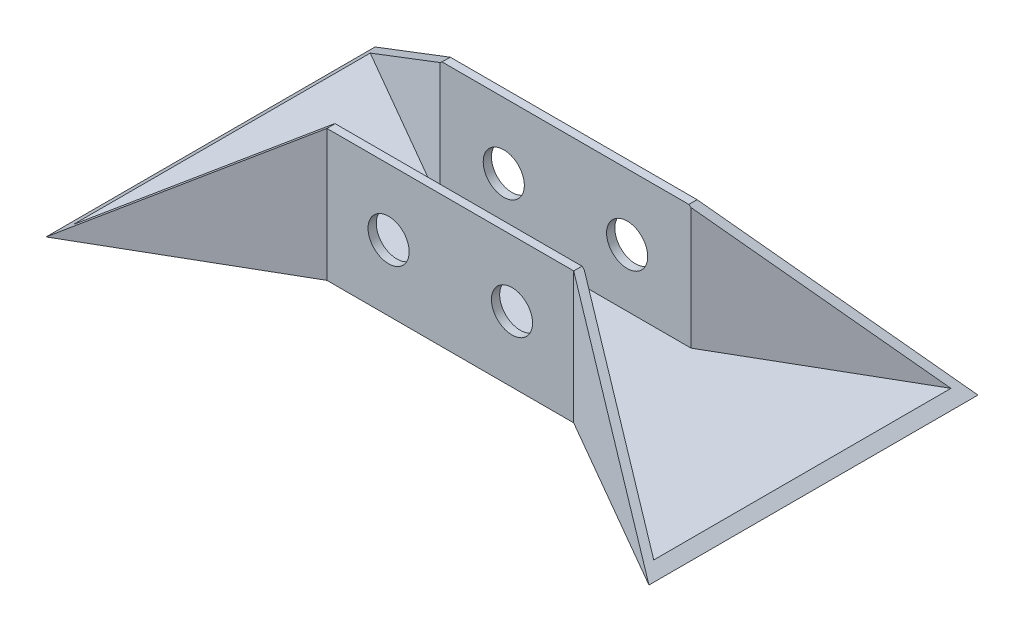
from build123d import *

# Parameters (mm, degrees)
BOSS_EXTRUDE1_DEPTH     = 5
BOSS_EXTRUDE2_DEPTH     = 75
CUT_EXTRUDE1_DEPTH      = 224.565932827
CUT_EXTRUDE1_DEPTH_BACK = 224.565932827
CUT_EXTRUDE2_DEPTH      = 224.565932827
CUT_EXTRUDE2_DEPTH_BACK = 224.565932827
SKETCH4_R               = 12.5


with BuildPart() as part:
    # Sketch1 → Boss-Extrude1 (new body)
    with BuildSketch(Plane(origin=(0, 0, 0), x_dir=(1, 0, 0), z_dir=(0, 1, 0))):
        Polygon((-183.253175473, 100), (-183.253175473, -100), (-75, -37.5), (75, -37.5), (183.253175473, -100), (183.253175473, 100), (75, 37.5), (-75, 37.5), align=None)
    extrude(amount=BOSS_EXTRUDE1_DEPTH)

    # Sketch2 → Boss-Extrude2 (add)
    with BuildSketch(Plane(origin=(0, 5, 0), x_dir=(1, 0, 0), z_dir=(0, 1, 0))):
        Polygon((-183.253175473, -100), (-75, -37.5), (75, -37.5), (183.253175473, -100), (183.253175473, -94.226497308), (76.339745962, -32.5), (-76.339745962, -32.5), (-183.253175473, -94.226497308), align=None)
        Polygon((-183.253175473, 100), (-75, 37.5), (75, 37.5), (183.253175473, 100), (183.253175473, 94.226497308), (76.339745962, 32.5), (-76.339745962, 32.5), (-183.253175473, 94.226497308), align=None)
    extrude(amount=BOSS_EXTRUDE2_DEPTH)

    # Sketch3 → Cut-Extrude1 (cut, two sides: drawn at the far end of the back side and taken through both)
    with BuildSketch(Plane.XY.offset(-CUT_EXTRUDE1_DEPTH_BACK)):
        Polygon((-183.253175473, 0), (-75, 80), (-183.253175473, 80), align=None)
        Polygon((183.253175473, 0), (75, 80), (183.253175473, 80), align=None)
    extrude(amount=CUT_EXTRUDE1_DEPTH + CUT_EXTRUDE1_DEPTH_BACK, mode=Mode.SUBTRACT)

    # Sketch4 → Cut-Extrude2 (cut, two sides: drawn at the far end of the back side and taken through both)
    with BuildSketch(Plane.XY.offset(-CUT_EXTRUDE2_DEPTH_BACK)):
        with Locations((-37.5, 40)):
            Circle(SKETCH4_R)
        with Locations((37.5, 40)):
            Circle(SKETCH4_R)
    extrude(amount=CUT_EXTRUDE2_DEPTH + CUT_EXTRUDE2_DEPTH_BACK, mode=Mode.SUBTRACT)


solid = part.part
